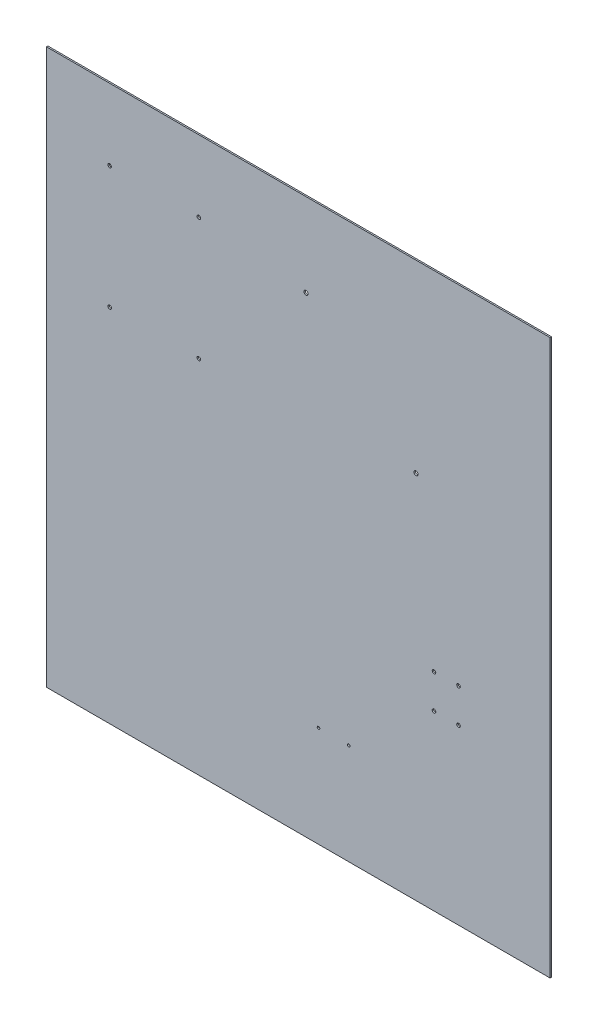
from build123d import *

# Parameters (mm, degrees)
ESQUISSE1_W             = 423
ESQUISSE1_H             = 466
BOSS_EXTRU_1_DEPTH      = 1.2
ESQUISSE2_R             = 1.5
ESQUISSE2_R_2           = 1.75
ESQUISSE2_R_3           = 1.1
ENL_V_MAT_EXTRU_1_DEPTH = 1.2


with BuildPart() as part:
    # Esquisse1 → Boss.-Extru.1 (new body)
    with BuildSketch(Plane.XY):
        with Locations((148.96064521, -197.792747525)):
            Rectangle(ESQUISSE1_W, ESQUISSE1_H)
    extrude(amount=BOSS_EXTRU_1_DEPTH)

    # Esquisse2 → Enlèv. mat.-Extru.1 (cut)
    with BuildSketch(Plane.XY.offset(1.2)):
        with Locations((-9.53935479, -24.792747525)):
            Circle(ESQUISSE2_R)
        with Locations((65.39064521, -24.792747525)):
            Circle(ESQUISSE2_R)
        with Locations((65.39064521, -127.662747525)):
            Circle(ESQUISSE2_R)
        with Locations((-9.53935479, -127.662747525)):
            Circle(ESQUISSE2_R)
        with Locations((155.39064521, -34.792747525)):
            Circle(ESQUISSE2_R_2)
        with Locations((247.89064521, -119.792747525)):
            Circle(ESQUISSE2_R_2)
        with Locations((262.974763868, -256.697283378)):
            Circle(ESQUISSE2_R)
        with Locations((262.974763868, -285.297283378)):
            Circle(ESQUISSE2_R)
        with Locations((283.574763868, -285.297283378)):
            Circle(ESQUISSE2_R)
        with Locations((283.574763868, -256.697283378)):
            Circle(ESQUISSE2_R)
        with Locations((165.954341109, -346.08211118)):
            Circle(ESQUISSE2_R_3)
        with Locations((191.354341109, -346.08211118)):
            Circle(ESQUISSE2_R_3)
    extrude(amount=-ENL_V_MAT_EXTRU_1_DEPTH, mode=Mode.SUBTRACT)


solid = part.part
